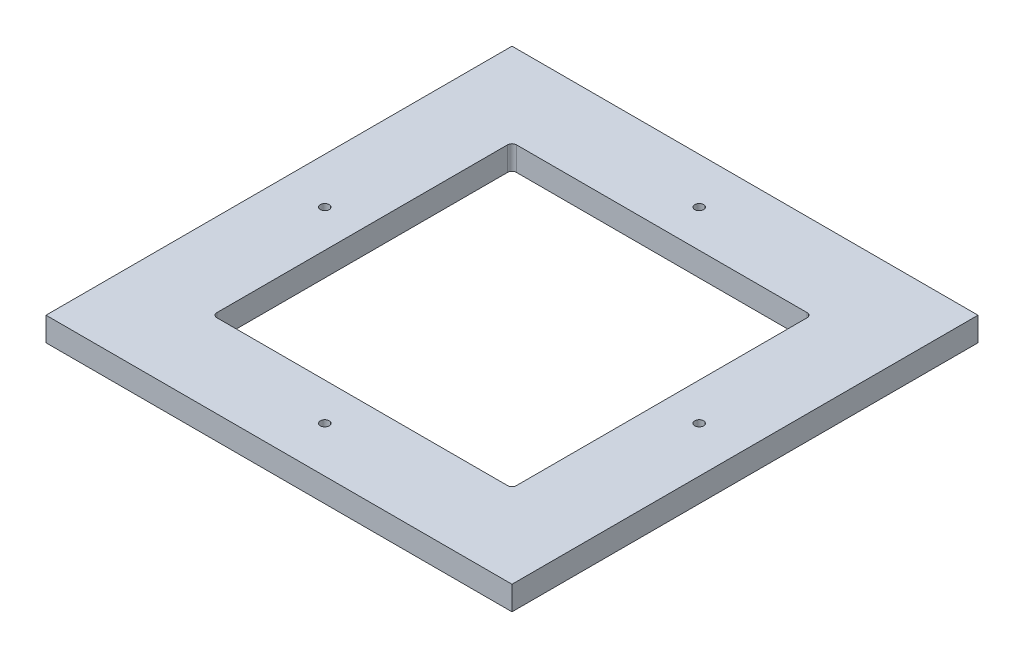
from build123d import *

# Parameters (mm, degrees)
SKETCH1_W               = 355.6
SKETCH1_H               = 355.6
BOSS_EXTRUDE1_DEPTH     = 18.25625
F_1_4_CLEARANCE_HOLE1_D = 6.7564
SKETCH8_W               = 228.6
SKETCH8_H               = 228.6
CUT_EXTRUDE3_DEPTH      = 253.109045185
FILLET2_R               = 3.3782


with BuildPart() as part:
    # Sketch1 → Boss-Extrude1 (new body)
    with BuildSketch(Plane(origin=(0, 0, 0), x_dir=(1, 0, 0), z_dir=(0, 1, 0))):
        Rectangle(SKETCH1_W, SKETCH1_H)
    extrude(amount=BOSS_EXTRUDE1_DEPTH)

    # 1/4 Clearance Hole1 (through all)
    with Locations(Plane(origin=(0, 18.25625, 0), x_dir=(1, 0, 0), z_dir=(0, 1, 0))):
        with Locations((0, 142.875), (-142.875, 0), (0, -142.875), (142.875, 0)):
            Hole(F_1_4_CLEARANCE_HOLE1_D / 2)

    # Sketch8 → Cut-Extrude3 (cut, through all)
    with BuildSketch(Plane(origin=(0, 18.25625, 0), x_dir=(1, 0, 0), z_dir=(0, 1, 0))):
        Rectangle(SKETCH8_W, SKETCH8_H)
    extrude(amount=-CUT_EXTRUDE3_DEPTH, mode=Mode.SUBTRACT)

    # Fillet2
    fillet2_edges = [part.edges().sort_by_distance(p)[0] for p in [
        (-114.3, 9.128125, 114.3),
        (-114.3, 9.128125, -114.3),
        (114.3, 9.128125, -114.3),
        (114.3, 9.128125, 114.3),
    ]]
    fillet(fillet2_edges, radius=FILLET2_R)


solid = part.part
